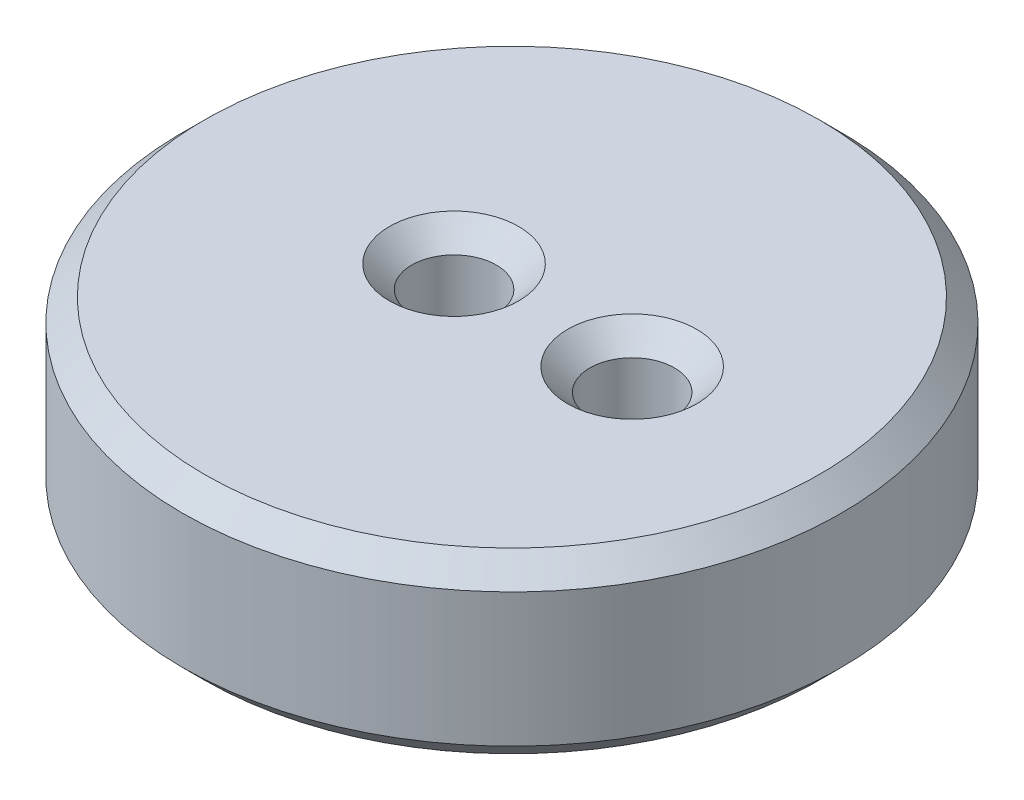
from build123d import *

# Parameters (mm, degrees)
SKETCH_1_R      = 7.4
SKETCH_1_R_2    = 0.95
EXTRUDE_1_DEPTH = 4
CHAMFER_1_SIZE  = 0.5


with BuildPart() as part:
    # 草图1 → 凸台-拉伸1 (new body)
    with BuildSketch(Plane(origin=(0, 0, 0), x_dir=(1, 0, 0), z_dir=(0, 1, 0))):
        Circle(SKETCH_1_R)
        with Locations((2.7, 0)):
            Circle(SKETCH_1_R_2, mode=Mode.SUBTRACT)
        with Locations((-1.3, 0)):
            Circle(SKETCH_1_R_2, mode=Mode.SUBTRACT)
    extrude(amount=EXTRUDE_1_DEPTH)

    # 倒角1
    chamfer_1_edges = [part.edges().sort_by_distance(p)[0] for p in [
        (-7.4, 0, 0),
        (-7.4, 4, 0),
        (-2.25, 0, 0),
        (1.75, 0, 0),
        (-2.25, 4, 0),
        (1.75, 4, 0),
    ]]
    chamfer(chamfer_1_edges, length=CHAMFER_1_SIZE)


solid = part.part
